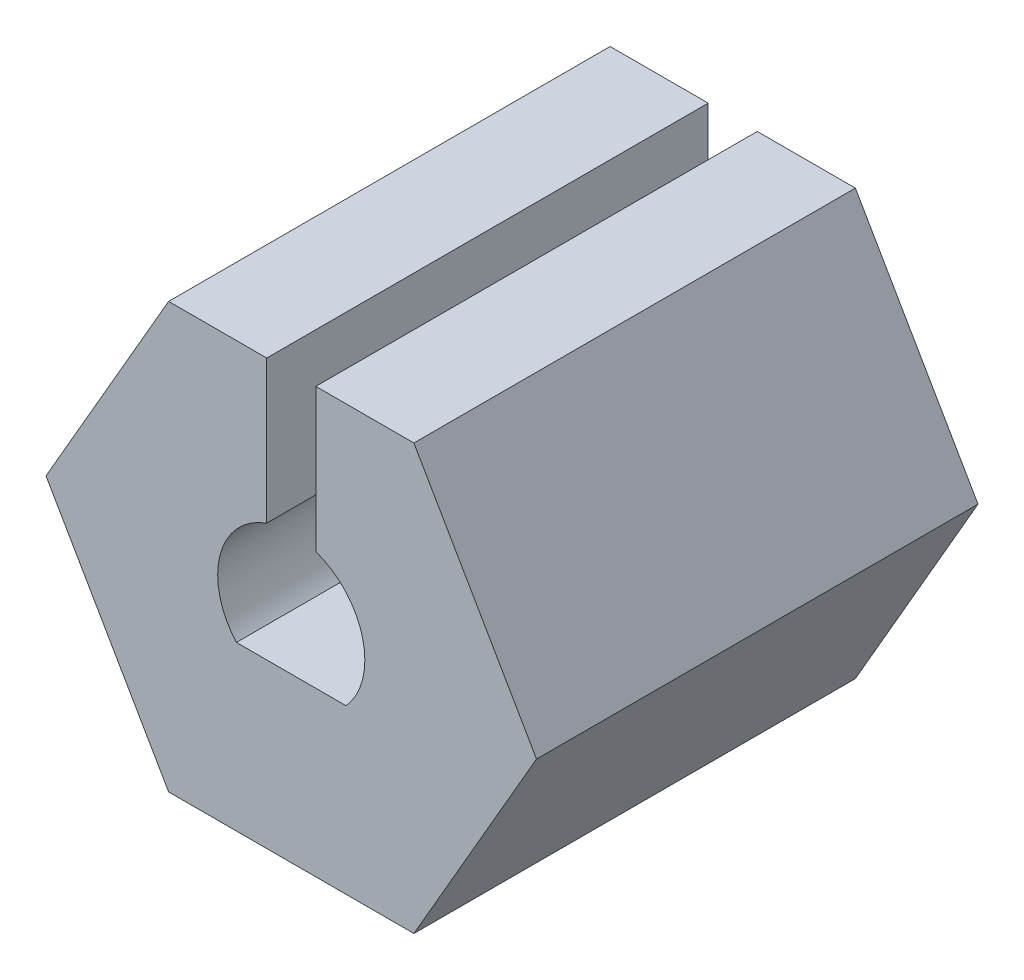
from build123d import *

# Parameters (mm, degrees)
BOSS_EXTRUDE1_DEPTH = 9


with BuildPart() as part:
    # Sketch1 → Boss-Extrude1 (new body)
    with BuildSketch(Plane.XY):
        with BuildLine():
            Line((1.118033989, -1), (-1.118033989, -1))
            ThreePointArc((-1.118033989, -1), (-1.4531398, 0.37200097), (-0.5, 1.414213562))
            Line((-0.5, 1.414213562), (-0.5, 4.330127019))
            Line((-0.5, 4.330127019), (-2.5, 4.330127019))
            Line((-2.5, 4.330127019), (-5, 0))
            Line((-5, 0), (-2.5, -4.330127019))
            Line((-2.5, -4.330127019), (2.5, -4.330127019))
            Line((2.5, -4.330127019), (5, 0))
            Line((5, 0), (2.5, 4.330127019))
            Line((2.5, 4.330127019), (0.5, 4.330127019))
            Line((0.5, 4.330127019), (0.5, 1.414213562))
            ThreePointArc((0.5, 1.414213562), (1.4531398, 0.37200097), (1.118033989, -1))
        make_face()
    extrude(amount=BOSS_EXTRUDE1_DEPTH)


solid = part.part
